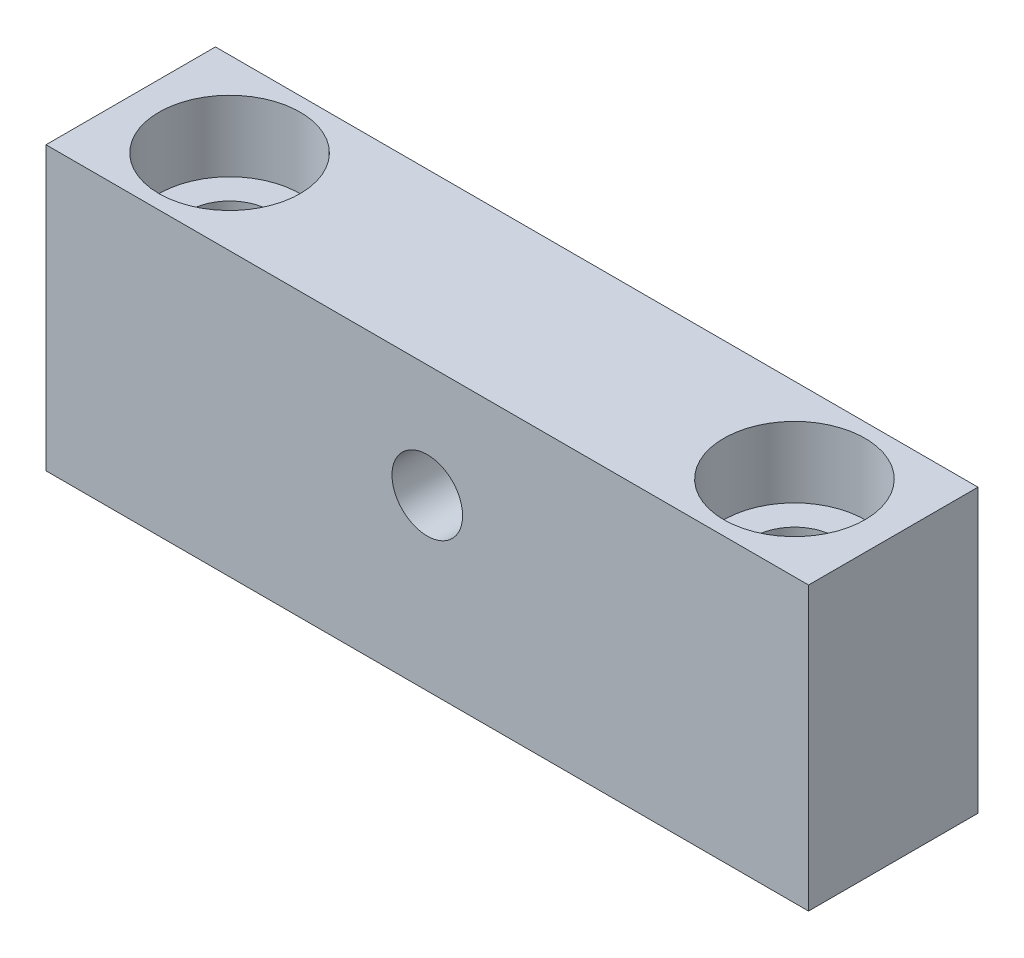
from build123d import *

# Parameters (mm, degrees)
SKETCH_1_W                   = 54
SKETCH_1_H                   = 20
EXTRUDE_1_DEPTH              = 12
HOLE_WIZARD_M6_1_D           = 5
HOLE_WIZARD_M5_1_D           = 5.8
HOLE_WIZARD_M5_1_CBORE_D     = 10
HOLE_WIZARD_M5_1_CBORE_DEPTH = 5


with BuildPart() as part:
    # 草图1 → 凸台-拉伸1 (new body)
    with BuildSketch(Plane.XY):
        with Locations((27, 10)):
            Rectangle(SKETCH_1_W, SKETCH_1_H)
    extrude(amount=EXTRUDE_1_DEPTH)

    # M6 螺纹孔1 (through all)
    with Locations(Plane.XY.offset(12)):
        with Locations((27, 12)):
            Hole(HOLE_WIZARD_M6_1_D / 2)

    # M5 六角凹头螺钉的柱形沉头孔1 (through all)
    with Locations(Plane(origin=(0, 20, 0), x_dir=(-1, 0, 0), z_dir=(0, 1, 0))):
        with Locations((-47, 6), (-7, 6)):
            CounterBoreHole(HOLE_WIZARD_M5_1_D / 2, HOLE_WIZARD_M5_1_CBORE_D / 2, HOLE_WIZARD_M5_1_CBORE_DEPTH)


solid = part.part
